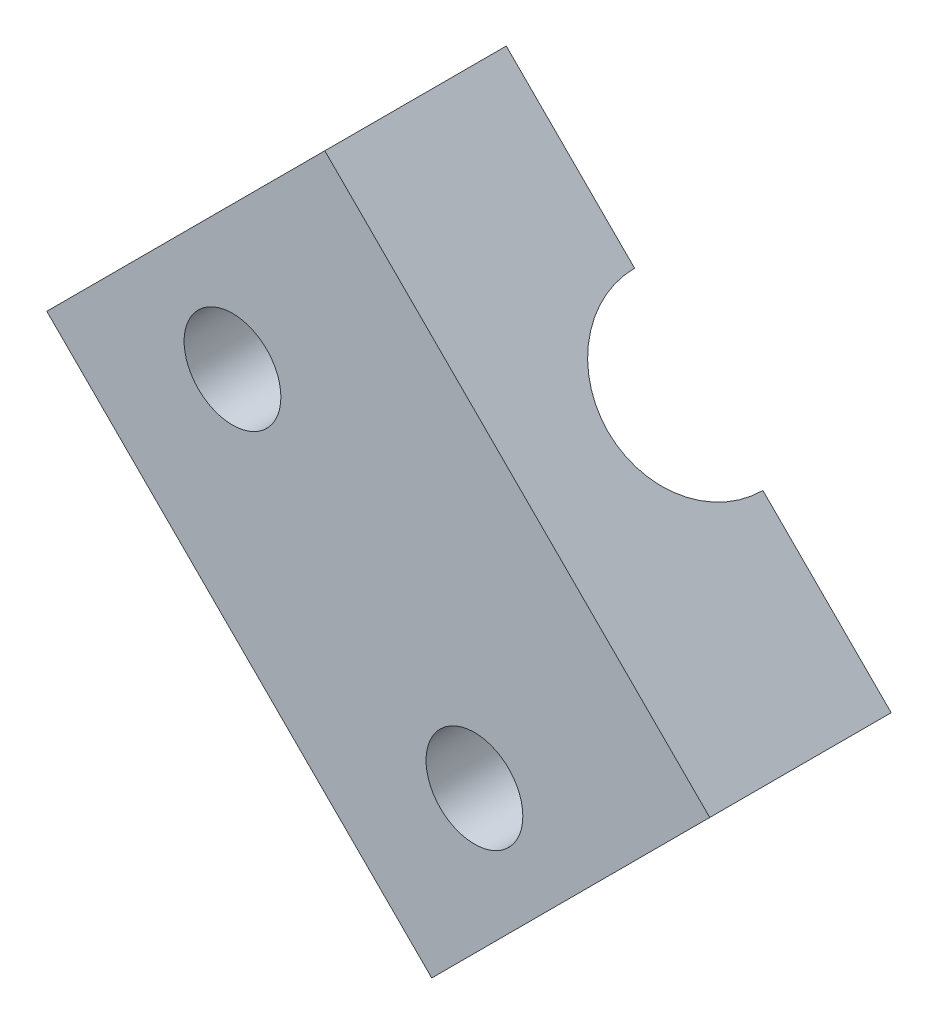
from build123d import *

# Parameters (mm, degrees)
EXTRUDE_1_DEPTH     = 13
EXTRUDE_2_DEPTH     = 3
SKETCH_4_R          = 1.6
CUT_EXTRUDE_1_DEPTH = 10


with BuildPart() as part:
    # 草图3 → 凸台-拉伸1 (new body)
    with BuildSketch(Plane(origin=(0, 0, 0), x_dir=(0, 0, -1), z_dir=(0.7071067811865488, 0.7071067811865464, 0))):
        with BuildLine():
            Line((0, 3), (0, 9))
            Line((0, 9), (-6, 9))
            Line((-6, 9), (-6, -9))
            Line((-6, -9), (0, -9))
            Line((0, -9), (0, -3))
            ThreePointArc((0, -3), (-3, 0), (0, 3))
        make_face()
    extrude(amount=EXTRUDE_1_DEPTH)

    # 草图5 → 凸台-拉伸2 (add)
    with BuildSketch(Plane(origin=(0, 0, 0), x_dir=(0, 0, 1), z_dir=(-0.7071067811865488, -0.7071067811865462, 0))):
        with BuildLine():
            Line((0, -1), (0, -3))
            ThreePointArc((0, -3), (2.121320344, -2.121320344), (3, 0))
            ThreePointArc((3, 0), (2.121320344, 2.121320344), (0, 3))
            Line((0, 3), (0, 1))
            ThreePointArc((0, 1), (0.707106781, 0.707106781), (1, 0))
            ThreePointArc((1, 0), (0.707106781, -0.707106781), (0, -1))
        make_face()
    extrude(amount=-EXTRUDE_2_DEPTH)

    # 草图4 → 切除-拉伸1 (cut)
    with BuildSketch(Plane.XY.offset(6)):
        with Locations((-0.224049788, 7.775950212)):
            Circle(SKETCH_4_R)
        with Locations((7.775950212, -0.224049788)):
            Circle(SKETCH_4_R)
    extrude(amount=-CUT_EXTRUDE_1_DEPTH, mode=Mode.SUBTRACT)


solid = part.part
